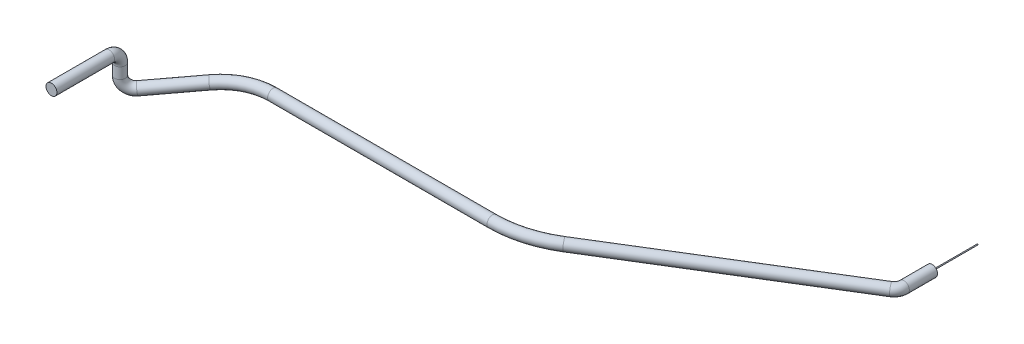
from build123d import *

# Parameters (mm, degrees)
SKETCH1_R           = 1.5
SKETCH2_R           = 0.125
BOSS_EXTRUDE1_DEPTH = 12.5


with BuildPart() as part:
    # Base-Sweep: sweep along a curve in space
    with BuildLine() as base_sweep_path:
        Line((60.65, -0.65, 0), (60.65, -0.65, 7.75208786))
        ThreePointArc((59.424167714, -0.560464146, 10.173638084), (60.325999238, -0.626334703, 9.109897397), (60.65, -0.65, 7.75208786))
        Line((59.424167714, -0.560464146, 10.173638084), (7.590881524, 3.225484065, 48.180781395))
        ThreePointArc((-7.239671238, 3.708602428, 53.030807816), (0.565798877, 3.584726574, 51.787217816), (7.590881524, 3.225484065, 48.180781395))
        Line((-7.239671238, 3.708602428, 53.030807816), (-67.575239414, 3.708602428, 53.030807816))
        ThreePointArc((-80.211652793, 2.635461889, 57.72083447), (-74.335914745, 3.431241001, 54.242981282), (-67.575239414, 3.708602428, 53.030807816))
        Line((-80.211652793, 2.635461889, 57.72083447), (-90.877343373, 0.516767824, 66.980322185))
        ThreePointArc((-93.478797639, 3.483575243, 69.238791399), (-92.69169695, 1.210351005, 68.555464885), (-90.877343373, 0.516767824, 66.980322185))
        Line((-93.478797639, 3.483575243, 69.238791399), (-93.478797639, 6.5, 69.238791399))
        ThreePointArc((-93.478797639, 9.5, 72.238791399), (-93.478797639, 8.621320344, 70.117471055), (-93.478797639, 6.5, 69.238791399))
        Line((-93.478797639, 9.5, 72.238791399), (-93.478797639, 9.5, 88.091291399))
    # Sketch1 → Base-Sweep (sweep)
    with BuildSketch(Plane.XY):
        with Locations((60.65, -0.65)):
            Circle(SKETCH1_R)
    sweep(path=base_sweep_path.line)

    # Sketch2 → Boss-Extrude1 (add)
    with BuildSketch(Plane(origin=(0, 0, 0), x_dir=(-1, 0, 0), z_dir=(0, 0, -1))):
        with Locations(Location((-60.65, -0.65, 0), (0, 0, 180))):
            Circle(SKETCH2_R)
    extrude(amount=BOSS_EXTRUDE1_DEPTH)


solid = part.part
